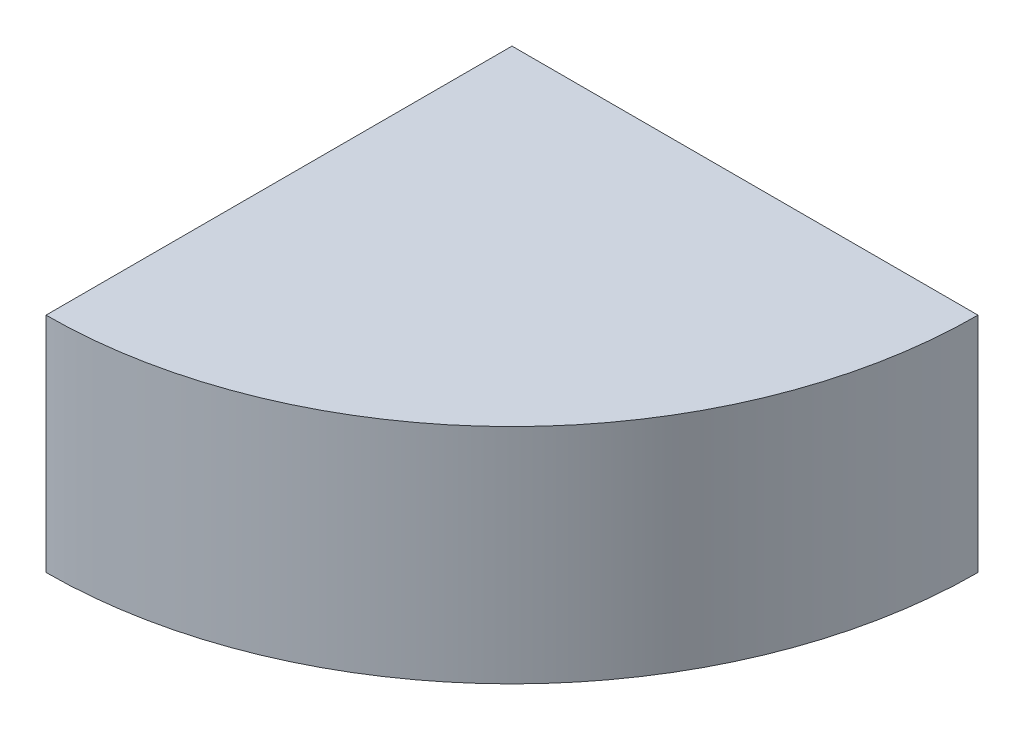
from build123d import *

# Parameters (mm, degrees)
SKETCH_1_W      = 230
SKETCH_1_H      = 110
SKETCH_1_R      = 3
REVOLVE_1_ANGLE = 90


with BuildPart() as part:
    # 草图1 → 旋转1 (revolve)
    with BuildSketch(Plane.XY):
        Rectangle(SKETCH_1_W, SKETCH_1_H)
        with Locations((-105, 45)):
            Circle(SKETCH_1_R, mode=Mode.SUBTRACT)
        with Locations((-105, -45)):
            Circle(SKETCH_1_R, mode=Mode.SUBTRACT)
        with Locations((105, -45)):
            Circle(SKETCH_1_R, mode=Mode.SUBTRACT)
        with Locations((105, 45)):
            Circle(SKETCH_1_R, mode=Mode.SUBTRACT)
    revolve(axis=Axis((-115, 55, 0), (0, -1, 0)), revolution_arc=REVOLVE_1_ANGLE)


solid = part.part
